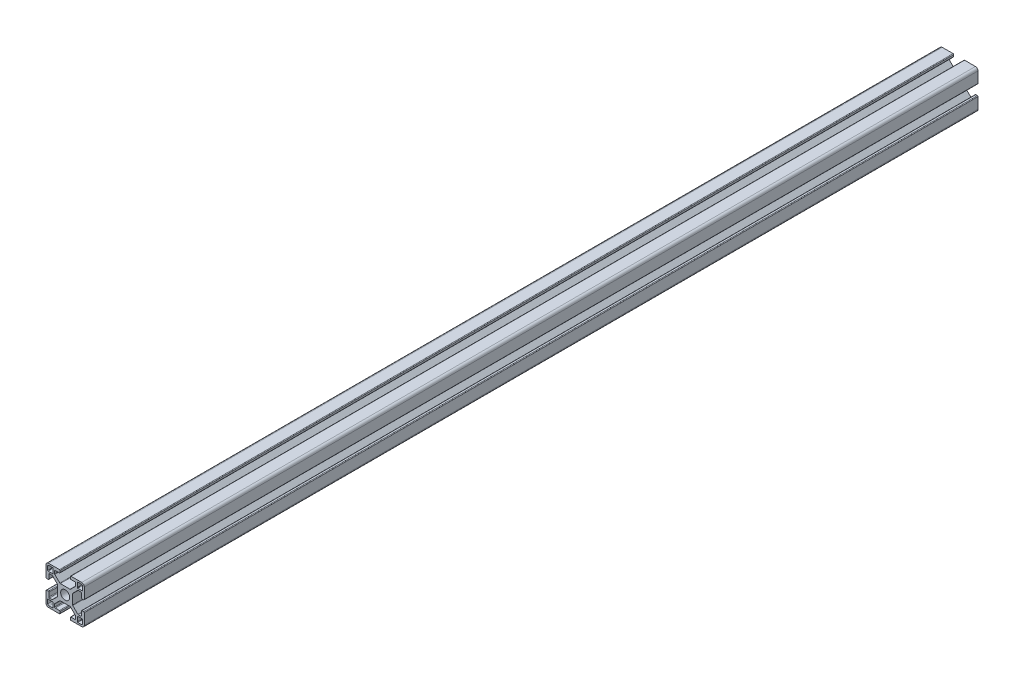
from build123d import *

# Parameters (mm, degrees)
SKETCH1_R           = 3.52998588
BOSS_EXTRUDE1_DEPTH = 350


with BuildPart() as part:
    # Sketch1 → Boss-Extrude1 (new, symmetric)
    with BuildSketch(Plane.XY):
        with BuildLine():
            Line((14.49994, -4), (13.24247465, -4))
            ThreePointArc((13.24247465, -4), (12.88892126, -4.146446609), (12.74247465, -4.5))
            Line((12.74247465, -4.5), (12.74247465, -7.732519321))
            ThreePointArc((12.74247465, -7.732519321), (12.602449697, -8.097296796), (12.242781236, -8.249967))
            Line((12.242781236, -8.249967), (10.260188032, -8.249967))
            ThreePointArc((10.260188032, -8.249967), (10.068847082, -8.211906919), (9.906636056, -8.103520976))
            Line((9.906636056, -8.103520976), (5.981117769, -4.178002689))
            ThreePointArc((5.981117769, -4.178002689), (5.872731827, -4.015791664), (5.834671745, -3.824450713))
            Line((5.834671745, -3.824450713), (5.834671745, -1.01249595))
            Line((5.834671745, -1.01249595), (5.834671745, 0.88749645))
            Line((5.834671745, 0.88749645), (5.834671745, 3.824450713))
            ThreePointArc((5.834671745, 3.824450713), (5.872731827, 4.015791664), (5.981117769, 4.178002689))
            Line((5.981117769, 4.178002689), (9.906636056, 8.103520976))
            ThreePointArc((9.906636056, 8.103520976), (10.068847082, 8.211906919), (10.260188032, 8.249967))
            Line((10.260188032, 8.249967), (12.242781236, 8.249967))
            ThreePointArc((12.242781236, 8.249967), (12.602449697, 8.097296796), (12.74247465, 7.732519321))
            Line((12.74247465, 7.732519321), (12.74247465, 4.5))
            ThreePointArc((12.74247465, 4.5), (12.88892126, 4.146446609), (13.24247465, 4))
            Line((13.24247465, 4), (14.49994, 4))
            ThreePointArc((14.49994, 4), (14.853493391, 4.146446609), (14.99994, 4.5))
            Line((14.99994, 4.5), (14.99994, 12.999948))
            ThreePointArc((14.99994, 12.999948), (14.414155906, 14.414155906), (12.999948, 14.99994))
            Line((12.999948, 14.99994), (4.5, 14.99994))
            ThreePointArc((4.5, 14.99994), (4.146446609, 14.853493391), (4, 14.49994))
            Line((4, 14.49994), (4, 13.24247465))
            ThreePointArc((4, 13.24247465), (4.146446609, 12.88892126), (4.5, 12.74247465))
            Line((4.5, 12.74247465), (7.732519321, 12.74247465))
            ThreePointArc((7.732519321, 12.74247465), (8.097296796, 12.602449697), (8.249967, 12.242781236))
            Line((8.249967, 12.242781236), (8.249967, 10.260188032))
            ThreePointArc((8.249967, 10.260188032), (8.211906919, 10.068847082), (8.103520976, 9.906636056))
            Line((8.103520976, 9.906636056), (4.178002689, 5.981117769))
            ThreePointArc((4.178002689, 5.981117769), (4.015791664, 5.872731827), (3.824450713, 5.834671745))
            Line((3.824450713, 5.834671745), (0.9499962, 5.834671745))
            Line((0.9499962, 5.834671745), (-0.9499962, 5.834671745))
            Line((-0.9499962, 5.834671745), (-3.824450713, 5.834671745))
            ThreePointArc((-3.824450713, 5.834671745), (-4.015791664, 5.872731827), (-4.178002689, 5.981117769))
            Line((-4.178002689, 5.981117769), (-8.103520976, 9.906636056))
            ThreePointArc((-8.103520976, 9.906636056), (-8.211906919, 10.068847082), (-8.249967, 10.260188032))
            Line((-8.249967, 10.260188032), (-8.249967, 12.242781236))
            ThreePointArc((-8.249967, 12.242781236), (-8.097296796, 12.602449697), (-7.732519321, 12.74247465))
            Line((-7.732519321, 12.74247465), (-4.5, 12.74247465))
            ThreePointArc((-4.5, 12.74247465), (-4.146446609, 12.88892126), (-4, 13.24247465))
            Line((-4, 13.24247465), (-4, 14.49994))
            ThreePointArc((-4, 14.49994), (-4.146446609, 14.853493391), (-4.5, 14.99994))
            Line((-4.5, 14.99994), (-12.999948, 14.99994))
            ThreePointArc((-12.999948, 14.99994), (-14.414155906, 14.414155906), (-14.99994, 12.999948))
            Line((-14.99994, 12.999948), (-14.99994, 4.5))
            ThreePointArc((-14.99994, 4.5), (-14.853493391, 4.146446609), (-14.49994, 4))
            Line((-14.49994, 4), (-13.24247465, 4))
            ThreePointArc((-13.24247465, 4), (-12.88892126, 4.146446609), (-12.74247465, 4.5))
            Line((-12.74247465, 4.5), (-12.74247465, 7.732519321))
            ThreePointArc((-12.74247465, 7.732519321), (-12.602449697, 8.097296796), (-12.242781236, 8.249967))
            Line((-12.242781236, 8.249967), (-10.260188032, 8.249967))
            ThreePointArc((-10.260188032, 8.249967), (-10.068847082, 8.211906919), (-9.906636056, 8.103520976))
            Line((-9.906636056, 8.103520976), (-5.981117769, 4.178002689))
            ThreePointArc((-5.981117769, 4.178002689), (-5.872731827, 4.015791664), (-5.834671745, 3.824450713))
            Line((-5.834671745, 3.824450713), (-5.834671745, 0.88749645))
            Line((-5.834671745, 0.88749645), (-5.834671745, -1.01249595))
            Line((-5.834671745, -1.01249595), (-5.834671745, -3.824450713))
            ThreePointArc((-5.834671745, -3.824450713), (-5.872731827, -4.015791664), (-5.981117769, -4.178002689))
            Line((-5.981117769, -4.178002689), (-9.906636056, -8.103520976))
            ThreePointArc((-9.906636056, -8.103520976), (-10.068847082, -8.211906919), (-10.260188032, -8.249967))
            Line((-10.260188032, -8.249967), (-12.242781236, -8.249967))
            ThreePointArc((-12.242781236, -8.249967), (-12.602449697, -8.097296796), (-12.74247465, -7.732519321))
            Line((-12.74247465, -7.732519321), (-12.74247465, -4.5))
            ThreePointArc((-12.74247465, -4.5), (-12.88892126, -4.146446609), (-13.24247465, -4))
            Line((-13.24247465, -4), (-14.49994, -4))
            ThreePointArc((-14.49994, -4), (-14.853493391, -4.146446609), (-14.99994, -4.5))
            Line((-14.99994, -4.5), (-14.99994, -12.999948))
            ThreePointArc((-14.99994, -12.999948), (-14.414155906, -14.414155906), (-12.999948, -14.99994))
            Line((-12.999948, -14.99994), (-4.5, -14.99994))
            ThreePointArc((-4.5, -14.99994), (-4.146446609, -14.853493391), (-4, -14.49994))
            Line((-4, -14.49994), (-4, -13.24247465))
            ThreePointArc((-4, -13.24247465), (-4.146446609, -12.88892126), (-4.5, -12.74247465))
            Line((-4.5, -12.74247465), (-7.732519321, -12.74247465))
            ThreePointArc((-7.732519321, -12.74247465), (-8.097296796, -12.602449697), (-8.249967, -12.242781236))
            Line((-8.249967, -12.242781236), (-8.249967, -10.260188032))
            ThreePointArc((-8.249967, -10.260188032), (-8.211906919, -10.068847082), (-8.103520976, -9.906636056))
            Line((-8.103520976, -9.906636056), (-4.178002689, -5.981117769))
            ThreePointArc((-4.178002689, -5.981117769), (-4.015791664, -5.872731827), (-3.824450713, -5.834671745))
            Line((-3.824450713, -5.834671745), (-0.9499962, -5.834671745))
            Line((-0.9499962, -5.834671745), (0.9499962, -5.834671745))
            Line((0.9499962, -5.834671745), (3.824450713, -5.834671745))
            ThreePointArc((3.824450713, -5.834671745), (4.015791664, -5.872731827), (4.178002689, -5.981117769))
            Line((4.178002689, -5.981117769), (8.103520976, -9.906636056))
            ThreePointArc((8.103520976, -9.906636056), (8.211906919, -10.068847082), (8.249967, -10.260188032))
            Line((8.249967, -10.260188032), (8.249967, -12.242781236))
            ThreePointArc((8.249967, -12.242781236), (8.097296796, -12.602449697), (7.732519321, -12.74247465))
            Line((7.732519321, -12.74247465), (4.5, -12.74247465))
            ThreePointArc((4.5, -12.74247465), (4.146446609, -12.88892126), (4, -13.24247465))
            Line((4, -13.24247465), (4, -14.49994))
            ThreePointArc((4, -14.49994), (4.146446609, -14.853493391), (4.5, -14.99994))
            Line((4.5, -14.99994), (12.999948, -14.99994))
            ThreePointArc((12.999948, -14.99994), (14.414155906, -14.414155906), (14.99994, -12.999948))
            Line((14.99994, -12.999948), (14.99994, -4.5))
            ThreePointArc((14.99994, -4.5), (14.853493391, -4.146446609), (14.49994, -4))
        make_face()
        Circle(SKETCH1_R, mode=Mode.SUBTRACT)
        with BuildLine():
            Line((-12.6999492, -13.6999452), (-9.880960476, -13.6999452))
            ThreePointArc((-9.880960476, -13.6999452), (-9.61155387, -13.58835333), (-9.499962, -13.318946724))
            Line((-9.499962, -13.318946724), (-9.499962, -9.87996048))
            ThreePointArc((-9.499962, -9.87996048), (-9.611260978, -9.611260978), (-9.87996048, -9.499962))
            Line((-9.87996048, -9.499962), (-13.318946724, -9.499962))
            ThreePointArc((-13.318946724, -9.499962), (-13.58835333, -9.61155387), (-13.6999452, -9.880960476))
            Line((-13.6999452, -9.880960476), (-13.6999452, -12.6999492))
            ThreePointArc((-13.6999452, -12.6999492), (-13.407053153, -13.407053153), (-12.6999492, -13.6999452))
        make_face(mode=Mode.SUBTRACT)
        with BuildLine():
            Line((13.6999452, -12.6999492), (13.6999452, -9.880960476))
            ThreePointArc((13.6999452, -9.880960476), (13.58835333, -9.61155387), (13.318946724, -9.499962))
            Line((13.318946724, -9.499962), (9.87996048, -9.499962))
            ThreePointArc((9.87996048, -9.499962), (9.611260978, -9.611260978), (9.499962, -9.87996048))
            Line((9.499962, -9.87996048), (9.499962, -13.318946724))
            ThreePointArc((9.499962, -13.318946724), (9.61155387, -13.58835333), (9.880960476, -13.6999452))
            Line((9.880960476, -13.6999452), (12.6999492, -13.6999452))
            ThreePointArc((12.6999492, -13.6999452), (13.407053153, -13.407053153), (13.6999452, -12.6999492))
        make_face(mode=Mode.SUBTRACT)
        with BuildLine():
            Line((9.87996048, 9.499962), (13.318946724, 9.499962))
            ThreePointArc((13.318946724, 9.499962), (13.58835333, 9.61155387), (13.6999452, 9.880960476))
            Line((13.6999452, 9.880960476), (13.6999452, 12.6999492))
            ThreePointArc((13.6999452, 12.6999492), (13.407053153, 13.407053153), (12.6999492, 13.6999452))
            Line((12.6999492, 13.6999452), (9.880960476, 13.6999452))
            ThreePointArc((9.880960476, 13.6999452), (9.61155387, 13.58835333), (9.499962, 13.318946724))
            Line((9.499962, 13.318946724), (9.499962, 9.87996048))
            ThreePointArc((9.499962, 9.87996048), (9.611260978, 9.611260978), (9.87996048, 9.499962))
        make_face(mode=Mode.SUBTRACT)
        with BuildLine():
            Line((-13.6999452, 12.6999492), (-13.6999452, 9.880960476))
            ThreePointArc((-13.6999452, 9.880960476), (-13.58835333, 9.61155387), (-13.318946724, 9.499962))
            Line((-13.318946724, 9.499962), (-9.87996048, 9.499962))
            ThreePointArc((-9.87996048, 9.499962), (-9.611260978, 9.611260978), (-9.499962, 9.87996048))
            Line((-9.499962, 9.87996048), (-9.499962, 13.318946724))
            ThreePointArc((-9.499962, 13.318946724), (-9.61155387, 13.58835333), (-9.880960476, 13.6999452))
            Line((-9.880960476, 13.6999452), (-12.6999492, 13.6999452))
            ThreePointArc((-12.6999492, 13.6999452), (-13.407053153, 13.407053153), (-13.6999452, 12.6999492))
        make_face(mode=Mode.SUBTRACT)
    extrude(amount=BOSS_EXTRUDE1_DEPTH, both=True)


solid = part.part
